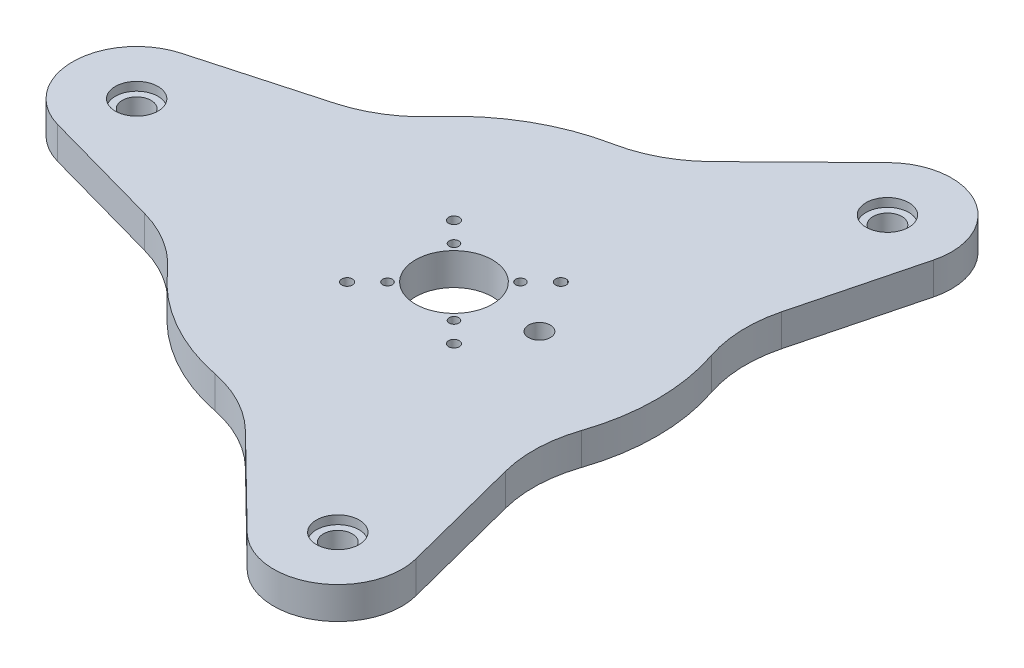
from build123d import *

# Parameters (mm, degrees)
SKETCH1_R                = 95
BOSS_EXTRUDE1_DEPTH      = 15
SKETCH2_R                = 10
BOSS_EXTRUDE2_DEPTH      = 15
FILLET1_R                = 60
SKETCH4_R                = 10
BOSS_EXTRUDE3_DEPTH      = 11
M12_CLEARANCE_HOLE1_D    = 13.5
CIRPATTERN1_COUNT        = 3
FILLET1_OF_CIRPATTERN1_R = 60
SKETCH7_R                = 18
CUT_EXTRUDE1_DEPTH       = 240.25451688
M4_CLEARANCE_HOLE1_D     = 4.5
M6_TAPPED_HOLE1_D        = 5
M12_TAPPED_HOLE1_D       = 10.2


with BuildPart() as part:
    # Sketch1 → Boss-Extrude1 (new body)
    with BuildSketch(Plane(origin=(0, 0, 0), x_dir=(1, 0, 0), z_dir=(0, 1, 0))):
        with Locations(Location((0, 0, 0), (0, 0, 270))):
            Circle(SKETCH1_R)
    extrude(amount=BOSS_EXTRUDE1_DEPTH)

    # Sketch2 → Boss-Extrude2 (add)
    with BuildSketch(Plane.XZ):
        with BuildLine():
            Line((-156.547830163, -28.900388054), (-80.777472107, -50))
            ThreePointArc((-80.777472107, -50), (-95, 0), (-80.777472107, 50))
            Line((-80.777472107, 50), (-156.547830163, 28.900388054))
            ThreePointArc((-156.547830163, 28.900388054), (-178.5, 0), (-156.547830163, -28.900388054))
        make_face()
        with Locations(Location((-148.5, 0, 0), (0, 0, 270))):
            Circle(SKETCH2_R, mode=Mode.SUBTRACT)
    boss_extrude2 = extrude(amount=-BOSS_EXTRUDE2_DEPTH)

    # Fillet1
    fillet1_edges = [part.edges().sort_by_distance(p)[0] for p in [
        (-80.777472107, 7.5, 50),
        (-80.777472107, 7.5, -50),
    ]]
    fillet(fillet1_edges, radius=FILLET1_R)

    # Sketch4 → Boss-Extrude3 (add)
    with BuildSketch(Plane.XZ):
        with Locations(Location((-148.5, 0, 0), (0, 0, 271.879376726))):
            Circle(SKETCH4_R)
    boss_extrude3 = extrude(amount=-BOSS_EXTRUDE3_DEPTH)

    # M12 Clearance Hole1 (through all)
    with Locations(Plane(origin=(0, 0, 0), x_dir=(-1, 0, 0), z_dir=(0, -1, 0))):
        with Locations((148.5, 0)):
            m12_clearance_hole1 = Hole(M12_CLEARANCE_HOLE1_D / 2)

    # CirPattern1: Boss-Extrude2, Boss-Extrude3, M12 Clearance Hole1 ×3 about axis
    cirpattern1_axis = Axis((0, 0, 0), (0, 1, 0))
    add([boss_extrude2.rotate(cirpattern1_axis, i * 360 / CIRPATTERN1_COUNT) for i in range(1, CIRPATTERN1_COUNT)])
    add([boss_extrude3.rotate(cirpattern1_axis, i * 360 / CIRPATTERN1_COUNT) for i in range(1, CIRPATTERN1_COUNT)])
    add([m12_clearance_hole1.rotate(cirpattern1_axis, i * 360 / CIRPATTERN1_COUNT) for i in range(1, CIRPATTERN1_COUNT)], mode=Mode.SUBTRACT)

    # Fillet1 of CirPattern1
    fillet1_of_cirpattern1_edges = [part.edges().sort_by_distance(p)[0] for p in [
        (83.690006243, 7.5, 44.955342898),
        (-2.912534136, 7.5, 94.955342898),
        (-2.912534136, 7.5, -94.955342898),
        (83.690006243, 7.5, -44.955342898),
    ]]
    fillet(fillet1_of_cirpattern1_edges, radius=FILLET1_OF_CIRPATTERN1_R)

    # Sketch7 → Cut-Extrude1 (cut, through all)
    with BuildSketch(Plane(origin=(0, 0, 0), x_dir=(-1, 0, 0), z_dir=(0, -1, 0))):
        with Locations(Location((0, 0, 0), (0, 0, 90))):
            Circle(SKETCH7_R)
    extrude(amount=-CUT_EXTRUDE1_DEPTH, mode=Mode.SUBTRACT)

    # M4 Clearance Hole1 (through all)
    with Locations(Plane(origin=(0, 15, 0), x_dir=(1, 0, 0), z_dir=(0, 1, 0))):
        with Locations((-15.556349186, -15.556349186), (15.556349186, -15.556349186), (15.556349186, 15.556349186), (-15.556349186, 15.556349186)):
            Hole(M4_CLEARANCE_HOLE1_D / 2)

    # M6 Tapped Hole1 (through all)
    with Locations(Plane(origin=(0, 0, 0), x_dir=(-1, 0, 0), z_dir=(0, -1, 0))):
        with Locations((0, 0), (25, 25), (-25, -25), (-25, 25), (25, -25)):
            Hole(M6_TAPPED_HOLE1_D / 2)

    # M12 Tapped Hole1 (through all)
    with Locations(Plane(origin=(0, 15, 0), x_dir=(1, 0, 0), z_dir=(0, 1, 0))):
        with Locations((40, 0)):
            Hole(M12_TAPPED_HOLE1_D / 2)


solid = part.part
